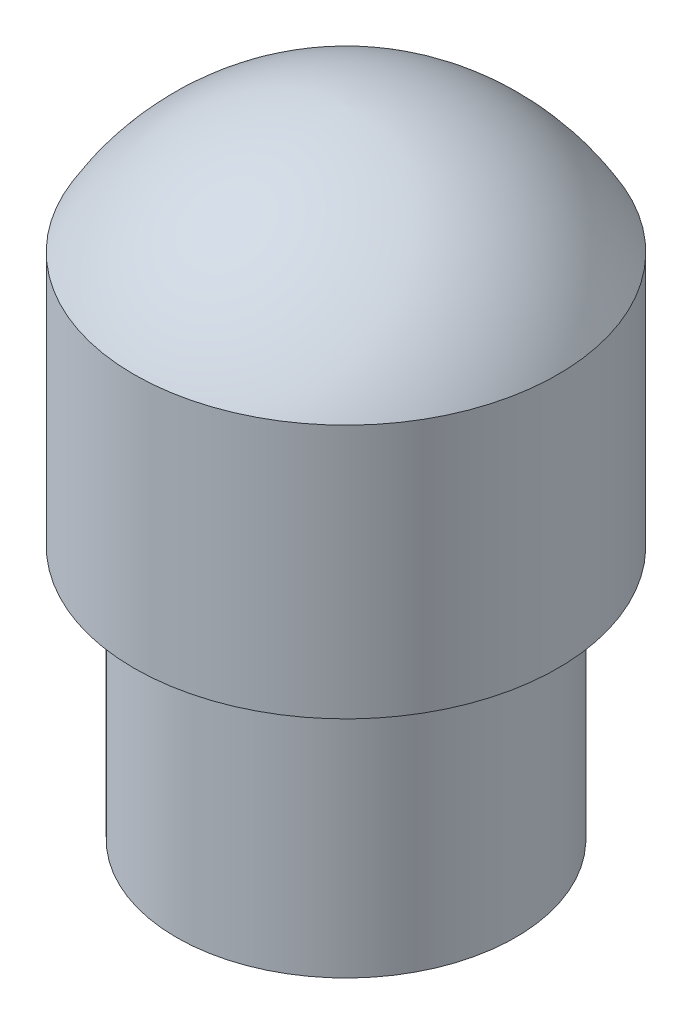
from build123d import *

# Parameters (mm, degrees)
CUT_EXTRUDE_1_DEPTH = 7


with BuildPart() as part:
    # ｽｹｯﾁ1 → 回転1 (revolve)
    with BuildSketch(Plane.XY, mode=Mode.PRIVATE) as revolve_1_sk:
        with BuildLine():
            Line((0, 0), (0, 15))
            ThreePointArc((0, 15), (2.888936029, 14.148226716), (5, 12))
            Line((5, 12), (5, 6))
            Line((5, 6), (4, 6))
            Line((4, 6), (4, 0))
            Line((4, 0), (0, 0))
        make_face()
    revolve(revolve_1_sk.sketch.rotate(Axis((0, 0, 0), (0, 1, 0)), 90), axis=Axis((0, 0, 0), (0, 1, 0)))

    # ｽｹｯﾁ2 → ｶｯﾄ - 押し出し1 (cut)
    with BuildSketch(Plane.XZ):
        Polygon((1.528213635, -2.449060313), (2.885055264, 0.098941674), (1.356841629, 2.548001987), (-1.528213635, 2.449060313), (-2.885055264, -0.098941674), (-1.356841629, -2.548001987), align=None)
    extrude(amount=-CUT_EXTRUDE_1_DEPTH, mode=Mode.SUBTRACT)


solid = part.part
